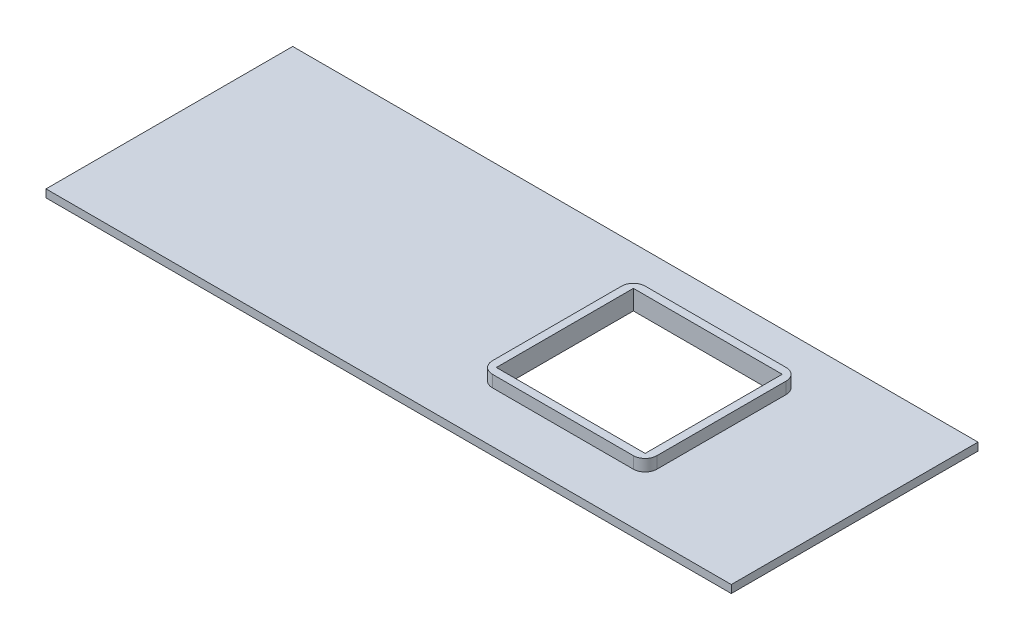
from build123d import *

# Parameters (mm, degrees)
SKETCH1_W           = 42
SKETCH1_H           = 39
SKETCH1_W_2         = 38
SKETCH1_H_2         = 35
BOSS_EXTRUDE1_DEPTH = 3
FILLET2_R           = 3
SKETCH5_W           = 175
SKETCH5_H           = 63
SKETCH5_W_2         = 38
SKETCH5_H_2         = 35
BOSS_EXTRUDE2_DEPTH = 2


with BuildPart() as part:
    # Sketch1 → Boss-Extrude1 (new body)
    with BuildSketch(Plane(origin=(0, 0, 0), x_dir=(1, 0, 0), z_dir=(0, 1, 0))):
        with Locations((-18.389520702, 9.684818057)):
            Rectangle(SKETCH1_W, SKETCH1_H)
        with Locations((-18.389520702, 9.684818057)):
            Rectangle(SKETCH1_W_2, SKETCH1_H_2, mode=Mode.SUBTRACT)
    extrude(amount=BOSS_EXTRUDE1_DEPTH)

    # Fillet2
    fillet2_edges = [part.edges().sort_by_distance(p)[0] for p in [
        (-39.389520702, 1.5, -29.184818057),
        (2.610479298, 1.5, -29.184818057),
        (2.610479298, 1.5, 9.815181943),
        (-39.389520702, 1.5, 9.815181943),
    ]]
    fillet(fillet2_edges, radius=FILLET2_R)

    # Sketch5 → Boss-Extrude2 (add)
    with BuildSketch(Plane.XZ):
        with Locations((-49.889520702, -8.684818057)):
            Rectangle(SKETCH5_W, SKETCH5_H)
        with Locations((-18.389520702, -9.684818057)):
            Rectangle(SKETCH5_W_2, SKETCH5_H_2, mode=Mode.SUBTRACT)
    extrude(amount=BOSS_EXTRUDE2_DEPTH)


solid = part.part
